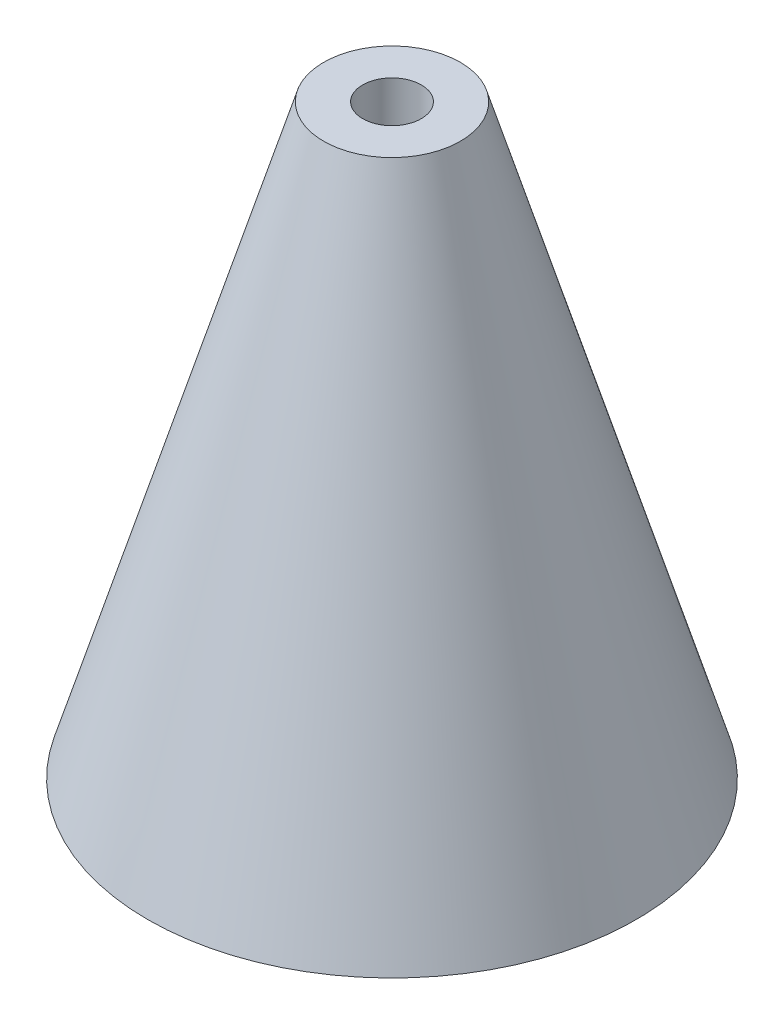
from build123d import *


with BuildPart() as part:
    # Эскиз1 → Повернуть1 (revolve)
    with BuildSketch(Plane.XY, mode=Mode.PRIVATE) as revolve_1_sk:
        Polygon((3, 60), (3, 0), (25, 0), (7, 60), align=None)
    revolve(revolve_1_sk.sketch.rotate(Axis((0, 0, 0), (0, 1, 0)), 90), axis=Axis((0, 0, 0), (0, 1, 0)))


solid = part.part
